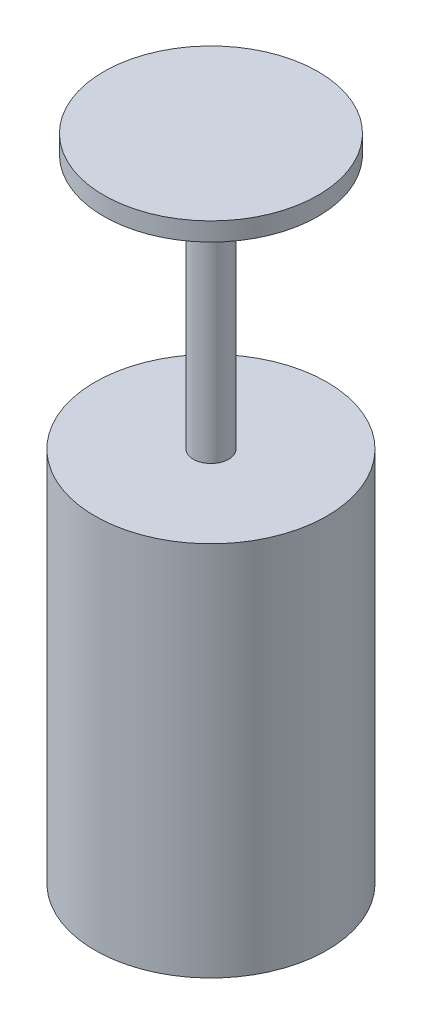
from build123d import *

# Parameters (mm, degrees)
SKETCH1_W   = 16.0655
SKETCH1_H   = 52.07
SKETCH1_W_2 = 2.450561434
SKETCH1_H_2 = 35.306


with BuildPart() as part:
    # Sketch1 → Revolve1 (revolve)
    with BuildSketch(Plane.XY, mode=Mode.PRIVATE) as revolve1_sk:
        with Locations((8.03275, -26.035)):
            Rectangle(SKETCH1_W, SKETCH1_H)
        with Locations((1.225280717, 17.653)):
            Rectangle(SKETCH1_W_2, SKETCH1_H_2)
        Polygon((0, 37.846), (0, 35.306), (2.450561434, 35.306), (14.836359841, 35.306), (14.836359841, 37.846), align=None)
    revolve(revolve1_sk.sketch.rotate(Axis((0, 0, 0), (0, 1, 0)), 90), axis=Axis((0, 0, 0), (0, 1, 0)))


solid = part.part
